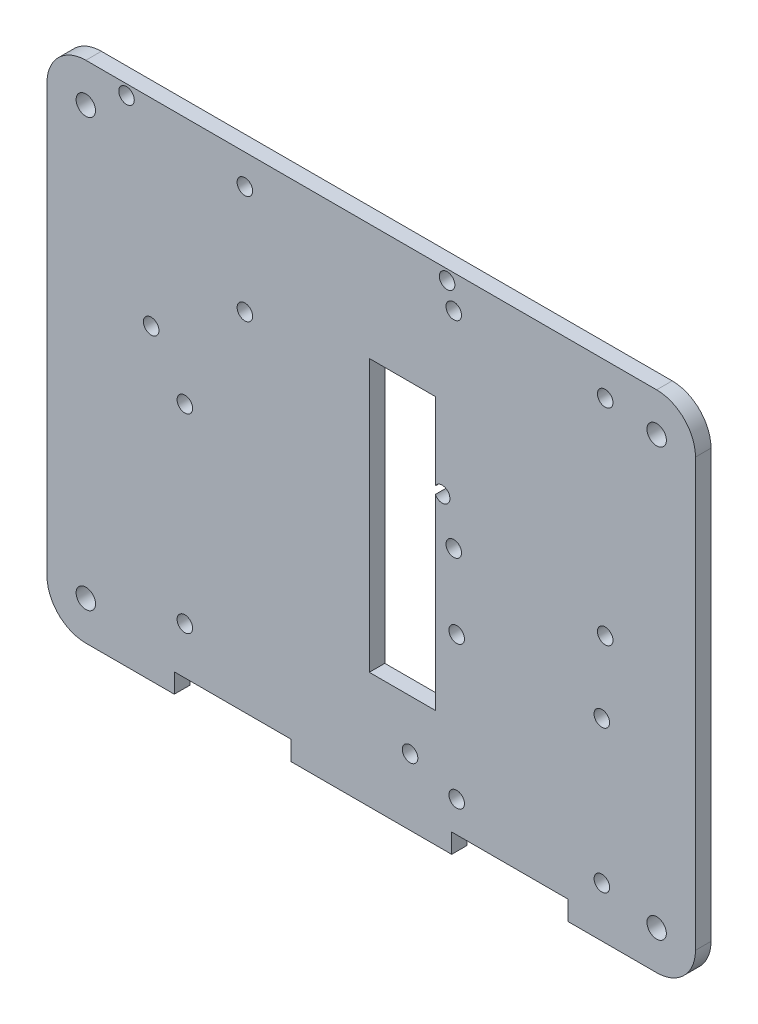
from build123d import *

# Parameters (mm, degrees)
SKETCH1_W           = 167
SKETCH1_H           = 130
BOSS_EXTRUDE1_DEPTH = 4
FILLET1_R           = 10
FILLET2_R           = 10
SKETCH5_R           = 2.5
CUT_EXTRUDE4_DEPTH  = 70
SKETCH6_W           = 30
SKETCH6_H           = 5
CUT_EXTRUDE5_DEPTH  = 10
SKETCH7_R           = 2
CUT_EXTRUDE6_DEPTH  = 106.892634305
SKETCH8_R           = 2
CUT_EXTRUDE7_DEPTH  = 106.892634305
SKETCH9_W           = 17
SKETCH9_H           = 70
CUT_EXTRUDE8_DEPTH  = 106.892634305
SKETCH10_R          = 2
CUT_EXTRUDE9_DEPTH  = 106.892634305
SKETCH11_R          = 2
CUT_EXTRUDE10_DEPTH = 106.892634305


with BuildPart() as part:
    # Sketch1 → Boss-Extrude1 (new body)
    with BuildSketch(Plane.XY):
        Rectangle(SKETCH1_W, SKETCH1_H)
    extrude(amount=BOSS_EXTRUDE1_DEPTH)

    # Fillet1
    fillet1_edges = [part.edges().sort_by_distance(p)[0] for p in [
        (-83.5, -65, 2),
        (-83.5, 65, 2),
    ]]
    fillet(fillet1_edges, radius=FILLET1_R)

    # Fillet2
    fillet2_edges = [part.edges().sort_by_distance(p)[0] for p in [
        (83.5, -65, 2),
        (83.5, 65, 2),
    ]]
    fillet(fillet2_edges, radius=FILLET2_R)

    # Sketch5 → Cut-Extrude4 (cut)
    with BuildSketch(Plane.XY.offset(4)):
        with Locations((-73.5, 55)):
            Circle(SKETCH5_R)
        with Locations((73.5, 55)):
            Circle(SKETCH5_R)
        with Locations((-73.5, -55)):
            Circle(SKETCH5_R)
        with Locations((73.5, -55)):
            Circle(SKETCH5_R)
    extrude(amount=-CUT_EXTRUDE4_DEPTH, mode=Mode.SUBTRACT)

    # Sketch6 → Cut-Extrude5 (cut)
    with BuildSketch(Plane.XY.offset(4)):
        with Locations((-35.714992286, -62.5)):
            Rectangle(SKETCH6_W, SKETCH6_H)
        with Locations((35.714992286, -62.5)):
            Rectangle(SKETCH6_W, SKETCH6_H)
    extrude(amount=-CUT_EXTRUDE5_DEPTH, mode=Mode.SUBTRACT)

    # Sketch7 → Cut-Extrude6 (cut, through all)
    with BuildSketch(Plane.XY.offset(4)):
        with Locations((22.006812394, -15.314288265)):
            Circle(SKETCH7_R)
        with Locations((59.386313266, -15.314288265)):
            Circle(SKETCH7_R)
        with Locations((59.386313266, -52.056088589)):
            Circle(SKETCH7_R)
        with Locations((22.006812394, -52.056088589)):
            Circle(SKETCH7_R)
    extrude(amount=-CUT_EXTRUDE6_DEPTH, mode=Mode.SUBTRACT)

    # Sketch8 → Cut-Extrude7 (cut, through all)
    with BuildSketch(Plane.XY.offset(4)):
        with Locations((21.25, 56.5)):
            Circle(SKETCH8_R)
        with Locations((60.25, 56.5)):
            Circle(SKETCH8_R)
        with Locations((60.25, 3.5)):
            Circle(SKETCH8_R)
        with Locations((21.25, 3.5)):
            Circle(SKETCH8_R)
    extrude(amount=-CUT_EXTRUDE7_DEPTH, mode=Mode.SUBTRACT)

    # Sketch9 → Cut-Extrude8 (cut, through all)
    with BuildSketch(Plane.XY.offset(4)):
        with Locations((8, 0)):
            Rectangle(SKETCH9_W, SKETCH9_H)
    extrude(amount=-CUT_EXTRUDE8_DEPTH, mode=Mode.SUBTRACT)

    # Sketch10 → Cut-Extrude9 (cut, through all)
    with BuildSketch(Plane.XY.offset(4)):
        with Locations((-48, 1.082115111)):
            Circle(SKETCH10_R)
        with Locations((10, -47.917884889)):
            Circle(SKETCH10_R)
        with Locations((-48, -47.917884889)):
            Circle(SKETCH10_R)
        with Locations((10, 1.082115111)):
            Circle(SKETCH10_R)
    extrude(amount=-CUT_EXTRUDE9_DEPTH, mode=Mode.SUBTRACT)

    # Sketch11 → Cut-Extrude10 (cut, through all)
    with BuildSketch(Plane.XY.offset(4)):
        with Locations((-63.02, 62.378539804)):
            Circle(SKETCH11_R)
        with Locations((-32.54, 57.298539804)):
            Circle(SKETCH11_R)
        with Locations((-32.54, 29.358539804)):
            Circle(SKETCH11_R)
        with Locations((19.53, 62.378539804)):
            Circle(SKETCH11_R)
        with Locations((18.26, 14.118539804)):
            Circle(SKETCH11_R)
        with Locations((-56.67, 14.118539804)):
            Circle(SKETCH11_R)
    extrude(amount=-CUT_EXTRUDE10_DEPTH, mode=Mode.SUBTRACT)


solid = part.part
